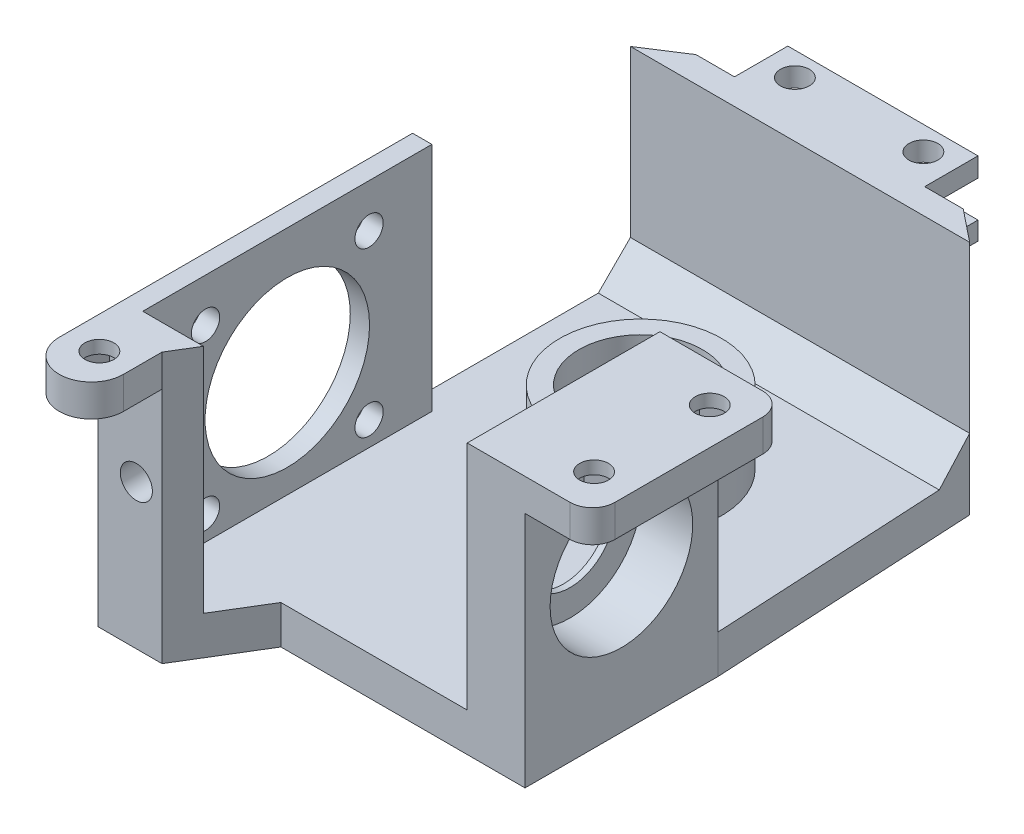
from build123d import *

# Parameters (mm, degrees)
BOSS_EXTRUDE1_DEPTH      = 5.75
BOSS_EXTRUDE1_DEPTH_BACK = 5.75
SKETCH1_W                = 29.6
SKETCH1_H                = 8.3
SKETCH1_R                = 2.25
CUT_EXTRUDE1_DEPTH       = 2.75
CUT_EXTRUDE1_DEPTH_BACK  = 2.9
SKETCH1_4_W              = 29.6
SKETCH1_4_H              = 8.3
SKETCH1_4_R              = 2.25
BOSS_EXTRUDE2_DEPTH      = 5.75
BOSS_EXTRUDE2_DEPTH_BACK = 25
BOSS_EXTRUDE3_START      = -25
SKETCH1_6_R              = 9.6
BOSS_EXTRUDE3_DEPTH      = 6
BOSS_EXTRUDE5_START      = -25
SKETCH1_8_W              = 9
SKETCH1_8_H              = 30
BOSS_EXTRUDE5_DEPTH      = 36
BOSS_EXTRUDE6_START      = -25
SKETCH1_10_W             = 9
SKETCH1_10_H             = 30
BOSS_EXTRUDE6_DEPTH      = 32.5
CUT_EXTRUDE3_START       = -1
SKETCH5_R                = 11.1
SKETCH5_R_2              = 7
CUT_EXTRUDE3_DEPTH       = 8
SKETCH5_4_R              = 7
CUT_EXTRUDE4_DEPTH       = 108.001168218
CHAMFER1_SIZE            = 5
BOSS_EXTRUDE7_START      = -31
SKETCH1_17_R             = 12.6
SKETCH1_17_R_2           = 9.6
SKETCH1_17_R_3           = 7
BOSS_EXTRUDE7_DEPTH      = 17.3
CUT_EXTRUDE7_START       = -13.7
SKETCH1_18_R             = 9.6
SKETCH1_18_R_2           = 7
CUT_EXTRUDE7_DEPTH       = 5
BOSS_EXTRUDE8_START      = 6
BOSS_EXTRUDE8_DEPTH      = 5
BOSS_EXTRUDE9_START      = 11
SKETCH1_21_R             = 2.25
BOSS_EXTRUDE9_DEPTH      = 2
CUT_EXTRUDE5_START       = 46
SKETCH5_5_R              = 11.1
SKETCH5_5_R_2            = 2.2
CUT_EXTRUDE5_DEPTH       = 8
SKETCH6_R                = 12.8
CUT_EXTRUDE9_DEPTH       = 114.795869872
CUT_EXTRUDE10_START      = 20
SKETCH7_R                = 2.5
CUT_EXTRUDE10_DEPTH      = 94.795869872


with BuildPart() as part:
    # Sketch1 → Boss-Extrude1 (new, two sides: drawn at the far end of the back side and taken through both)
    with BuildSketch(Plane(origin=(0, 0, 0), x_dir=(1, 0, 0), z_dir=(0, 1, 0)).offset(-BOSS_EXTRUDE1_DEPTH_BACK)):
        with Locations((0, -0.45)):
            Rectangle(SKETCH1_W, SKETCH1_H)
        with Locations(Location((-10, 0, 0), (0, 0, 270))):
            Circle(SKETCH1_R, mode=Mode.SUBTRACT)
        with Locations(Location((10, 0, 0), (0, 0, 270))):
            Circle(SKETCH1_R, mode=Mode.SUBTRACT)
    extrude(amount=BOSS_EXTRUDE1_DEPTH + BOSS_EXTRUDE1_DEPTH_BACK)

    # Sketch1<4> → Cut-Extrude1 (cut, two sides: drawn at the far end of the back side and taken through both)
    with BuildSketch(Plane(origin=(0, 0, 0), x_dir=(1, 0, 0), z_dir=(0, 1, 0)).offset(-CUT_EXTRUDE1_DEPTH_BACK)):
        with Locations((0, -0.45)):
            Rectangle(SKETCH1_4_W, SKETCH1_4_H)
        with Locations(Location((-10, 0, 0), (0, 0, 270))):
            Circle(SKETCH1_4_R, mode=Mode.SUBTRACT)
        with Locations(Location((10, 0, 0), (0, 0, 270))):
            Circle(SKETCH1_4_R, mode=Mode.SUBTRACT)
    extrude(amount=CUT_EXTRUDE1_DEPTH + CUT_EXTRUDE1_DEPTH_BACK, mode=Mode.SUBTRACT)


with BuildPart() as cut_extrude1_piece_1:
    # of the separate pieces the step leaves, piece 1, a body of its own (cut_extrude1_pieces)
    add(part.part.solids().sort_by_distance((-14.8, 2.75, -3.7))[0])



with BuildPart() as cut_extrude1_piece_2:
    # of the separate pieces the step leaves, piece 2, a body of its own (cut_extrude1_pieces)
    add(part.part.solids().sort_by_distance((-14.8, -5.75, -3.7))[0])


with BuildPart() as cut_extrude1_piece_1_1:
    add(cut_extrude1_piece_1.part)

    add(cut_extrude1_piece_2.part)  # Boss-Extrude2 merges Cut-Extrude1 piece 2
    # Sketch1<5> → Boss-Extrude2 (add, two sides: drawn at the far end of the back side and taken through both)
    with BuildSketch(Plane(origin=(0, 0, 0), x_dir=(1, 0, 0), z_dir=(0, 1, 0)).offset(-BOSS_EXTRUDE2_DEPTH_BACK)):
        Polygon((14.8, -4.6), (-14.8, -4.6), (-20.8, -4.6), (-27, -8.6), (25.8, -8.6), (20.8, -4.6), align=None)
    extrude(amount=BOSS_EXTRUDE2_DEPTH + BOSS_EXTRUDE2_DEPTH_BACK)

    # Sketch1<6> → Boss-Extrude3 (add)
    with BuildSketch(Plane(origin=(0, 0, 0), x_dir=(1, 0, 0), z_dir=(0, 1, 0)).offset(BOSS_EXTRUDE3_START)):
        Polygon((-20.8, -4.6), (-27, -8.6), (-27, -91.5), (-17, -91.5), (-10, -80), (28, -80), (28, -50), (25.8, -8.6), (20.8, -4.6), align=None)
        with Locations(Location((0, -34, 0), (0, 0, 270))):
            Circle(SKETCH1_6_R, mode=Mode.SUBTRACT)
    extrude(amount=-BOSS_EXTRUDE3_DEPTH)

    # Sketch1<8> → Boss-Extrude5 (add)
    with BuildSketch(Plane(origin=(0, 0, 0), x_dir=(1, 0, 0), z_dir=(0, 1, 0)).offset(BOSS_EXTRUDE5_START)):
        Polygon((-24, -42.5), (-27, -42.5), (-27, -91.5), (-17, -91.5), (-14.565217391, -87.5), (-24, -87.5), align=None)
        with Locations((23.5, -65)):
            Rectangle(SKETCH1_8_W, SKETCH1_8_H)
    extrude(amount=BOSS_EXTRUDE5_DEPTH)

    # Sketch1<10> → Boss-Extrude6 (add)
    with BuildSketch(Plane(origin=(0, 0, 0), x_dir=(1, 0, 0), z_dir=(0, 1, 0)).offset(BOSS_EXTRUDE6_START)):
        with Locations((23.5, -65)):
            Rectangle(SKETCH1_10_W, SKETCH1_10_H)
    extrude(amount=BOSS_EXTRUDE6_DEPTH)

    # Sketch5 → Cut-Extrude3 (cut)
    # profile 1 of 2: a face of its own
    with BuildSketch(Plane.ZY.offset(-19).offset(CUT_EXTRUDE3_START)):
        with Locations((65, -8.5)):
            Circle(SKETCH5_R)
        with Locations((65, -8.5)):
            Circle(SKETCH5_R_2, mode=Mode.SUBTRACT)
    # profile 2 of 2: a face of its own
    with BuildSketch(Plane.ZY.offset(-19).offset(CUT_EXTRUDE3_START)):
        with Locations((65, -8.5)):
            Circle(SKETCH5_R_2)
    extrude(amount=-CUT_EXTRUDE3_DEPTH, mode=Mode.SUBTRACT)

    # Sketch5<4> → Cut-Extrude4 (cut, through all)
    with BuildSketch(Plane.ZY.offset(-19)):
        with Locations((65, -8.5)):
            Circle(SKETCH5_4_R)
    extrude(amount=-CUT_EXTRUDE4_DEPTH, mode=Mode.SUBTRACT)

    # Chamfer1
    chamfer1_edges = [cut_extrude1_piece_1_1.edges().sort_by_distance(p)[0] for p in [
        (-0.6, -25, 8.6),
    ]]
    chamfer(chamfer1_edges, length=CHAMFER1_SIZE)

    # Sketch1<17> → Boss-Extrude7 (add)
    # profile 1 of 2: a face of its own
    with BuildSketch(Plane(origin=(0, 0, 0), x_dir=(1, 0, 0), z_dir=(0, 1, 0)).offset(BOSS_EXTRUDE7_START)):
        with Locations(Location((0, -34, 0), (0, 0, 270))):
            Circle(SKETCH1_17_R)
        with Locations((0, -34)):
            Circle(SKETCH1_17_R_2, mode=Mode.SUBTRACT)
    # profile 2 of 2: a face of its own
    with BuildSketch(Plane(origin=(0, 0, 0), x_dir=(1, 0, 0), z_dir=(0, 1, 0)).offset(BOSS_EXTRUDE7_START)):
        with Locations((0, -34)):
            Circle(SKETCH1_17_R_2)
        with Locations(Location((0, -34, 0), (0, 0, 270))):
            Circle(SKETCH1_17_R_3, mode=Mode.SUBTRACT)
    extrude(amount=BOSS_EXTRUDE7_DEPTH)

    # Sketch1<18> → Cut-Extrude7 (cut)
    with BuildSketch(Plane(origin=(0, 0, 0), x_dir=(1, 0, 0), z_dir=(0, 1, 0)).offset(CUT_EXTRUDE7_START)):
        with Locations(Location((0, -34, 0), (0, 0, 270))):
            Circle(SKETCH1_18_R)
        with Locations(Location((0, -34, 0), (0, 0, 270))):
            Circle(SKETCH1_18_R_2, mode=Mode.SUBTRACT)
    extrude(amount=-CUT_EXTRUDE7_DEPTH, mode=Mode.SUBTRACT)

    # Sketch1<20> → Boss-Extrude8 (add)
    # profile 1 of 2: a face of its own
    with BuildSketch(Plane(origin=(0, 0, 0), x_dir=(1, 0, 0), z_dir=(0, 1, 0)).offset(BOSS_EXTRUDE8_START)):
        with BuildLine():
            Line((35, -50), (28, -50))
            Line((28, -50), (28, -80))
            Line((28, -80), (35, -80))
            ThreePointArc((35, -80), (37.474873734, -78.974873734), (38.5, -76.5))
            Line((38.5, -76.5), (38.5, -53.5))
            ThreePointArc((38.5, -53.5), (37.474873734, -51.025126266), (35, -50))
        make_face()
        Polygon((32.75, -78.330127019), (29, -76.165063509), (29, -71.834936491), (32.75, -69.669872981), (36.5, -71.834936491), (36.5, -76.165063509), align=None, mode=Mode.SUBTRACT)
        Polygon((36.5, -58.165063509), (32.75, -60.330127019), (29, -58.165063509), (29, -53.834936491), (32.75, -51.669872981), (36.5, -53.834936491), align=None, mode=Mode.SUBTRACT)
    # profile 2 of 2: a face of its own
    with BuildSketch(Plane(origin=(0, 0, 0), x_dir=(1, 0, 0), z_dir=(0, 1, 0)).offset(BOSS_EXTRUDE8_START)):
        with BuildLine():
            Line((-17, -91.5), (-27, -91.5))
            Line((-27, -91.5), (-27, -97.5))
            ThreePointArc((-27, -97.5), (-22, -102.5), (-17, -97.5))
            Line((-17, -97.5), (-17, -91.5))
        make_face()
        Polygon((-19.834936491, -92.5), (-17.669872981, -96.25), (-19.834936491, -100), (-24.165063509, -100), (-26.330127019, -96.25), (-24.165063509, -92.5), align=None, mode=Mode.SUBTRACT)
    extrude(amount=BOSS_EXTRUDE8_DEPTH)

    # Sketch1<21> → Boss-Extrude9 (add)
    # profile 1 of 3: a face of its own
    with BuildSketch(Plane(origin=(0, 0, 0), x_dir=(1, 0, 0), z_dir=(0, 1, 0)).offset(BOSS_EXTRUDE9_START)):
        Polygon((29, -53.834936491), (29, -58.165063509), (32.75, -60.330127019), (36.5, -58.165063509), (36.5, -53.834936491), (32.75, -51.669872981), align=None)
        with Locations(Location((32.75, -56, 0), (0, 0, 270))):
            Circle(SKETCH1_21_R, mode=Mode.SUBTRACT)
    # profile 2 of 3: a face of its own
    with BuildSketch(Plane(origin=(0, 0, 0), x_dir=(1, 0, 0), z_dir=(0, 1, 0)).offset(BOSS_EXTRUDE9_START)):
        Polygon((32.75, -69.669872981), (29, -71.834936491), (29, -76.165063509), (32.75, -78.330127019), (36.5, -76.165063509), (36.5, -71.834936491), align=None)
        with Locations(Location((32.75, -74, 0), (0, 0, 270))):
            Circle(SKETCH1_21_R, mode=Mode.SUBTRACT)
    # profile 3 of 3: a face of its own
    with BuildSketch(Plane(origin=(0, 0, 0), x_dir=(1, 0, 0), z_dir=(0, 1, 0)).offset(BOSS_EXTRUDE9_START)):
        Polygon((-24.165063509, -100), (-19.834936491, -100), (-17.669872981, -96.25), (-19.834936491, -92.5), (-24.165063509, -92.5), (-26.330127019, -96.25), align=None)
        with Locations(Location((-22, -96.25, 0), (0, 0, 270))):
            Circle(SKETCH1_21_R, mode=Mode.SUBTRACT)
    extrude(amount=-BOSS_EXTRUDE9_DEPTH)

    # Sketch5<5> → Cut-Extrude5 (cut)
    with BuildSketch(Plane.ZY.offset(-19).offset(CUT_EXTRUDE5_START)):
        with Locations((65, -8.5)):
            Circle(SKETCH5_5_R)
        with Locations((52.272077939, 4.227922061)):
            Circle(SKETCH5_5_R_2)
        with Locations((77.727922061, 4.227922061)):
            Circle(SKETCH5_5_R_2)
        with Locations((77.727922061, -21.227922061)):
            Circle(SKETCH5_5_R_2)
        with Locations((52.272077939, -21.227922061)):
            Circle(SKETCH5_5_R_2)
    extrude(amount=-CUT_EXTRUDE5_DEPTH, mode=Mode.SUBTRACT)

    # Sketch6 → Cut-Extrude9 (cut, through all)
    with BuildSketch(Plane(origin=(0, 0, 0), x_dir=(0, 0, -1), z_dir=(1, 0, 0))):
        with Locations((-65, -8.5)):
            Circle(SKETCH6_R)
    extrude(amount=-CUT_EXTRUDE9_DEPTH, mode=Mode.SUBTRACT)

    # Sketch7 → Cut-Extrude10 (cut, through all)
    with BuildSketch(Plane.XY.offset(CUT_EXTRUDE10_START)):
        with Locations(Location((-21, -8.5, 0), (0, 0, 180))):
            Circle(SKETCH7_R)
    extrude(amount=CUT_EXTRUDE10_DEPTH, mode=Mode.SUBTRACT)


solid = cut_extrude1_piece_1_1.part
